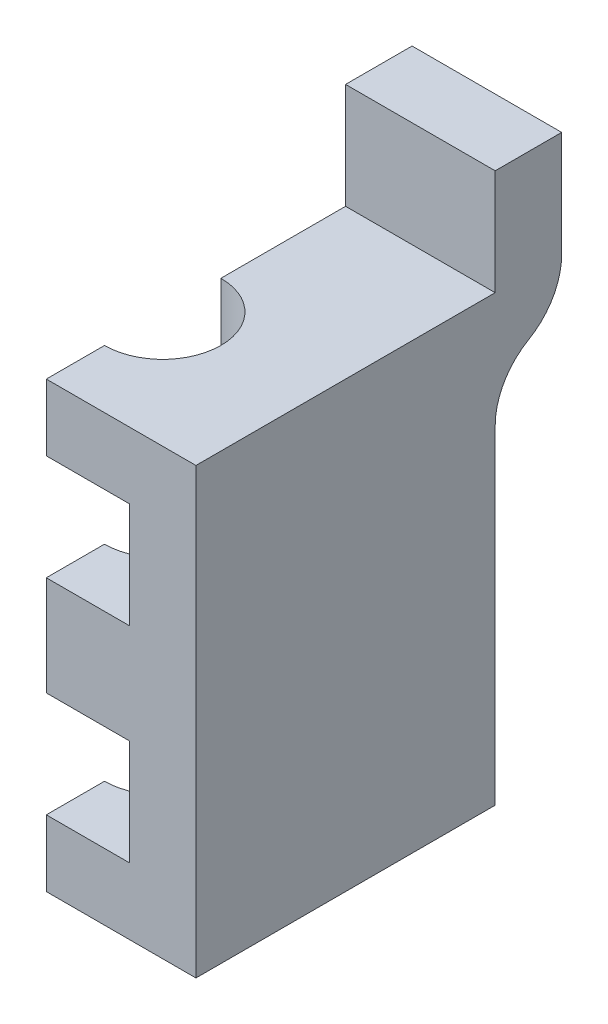
from build123d import *

# Parameters (mm, degrees)
BOSS_EXTRUDE3_DEPTH = 3.5
SKETCH6_W           = 4.5
SKETCH6_H           = 13.35
BOSS_EXTRUDE4_DEPTH = 2
SKETCH7_R           = 1.75
CUT_EXTRUDE2_DEPTH  = 16.123574313
BOSS_EXTRUDE7_DEPTH = 4.5
FILLET1_R           = 2


with BuildPart() as part:
    # Sketch5 → Boss-Extrude3 (new, symmetric)
    with BuildSketch(Plane.XY):
        Polygon((0, 0), (4.5, 0), (4.5, -13.35), (0, -13.35), (0, -11.35), (2.5, -11.35), (2.5, -8.175), (0, -8.175), (0, -5.175), (2.5, -5.175), (2.5, -2), (0, -2), align=None)
    extrude(amount=BOSS_EXTRUDE3_DEPTH, both=True)

    # Sketch6 → Boss-Extrude4 (add)
    with BuildSketch(Plane(origin=(0, 0, -3.5), x_dir=(-1, 0, 0), z_dir=(0, 0, -1))):
        with Locations((-2.25, -6.675)):
            Rectangle(SKETCH6_W, SKETCH6_H)
    extrude(amount=BOSS_EXTRUDE4_DEPTH)

    # Sketch7 → Cut-Extrude2 (cut, through all)
    with BuildSketch(Plane(origin=(0, 0, 0), x_dir=(1, 0, 0), z_dir=(0, 1, 0))):
        Circle(SKETCH7_R)
    extrude(amount=-CUT_EXTRUDE2_DEPTH, mode=Mode.SUBTRACT)

    # Sketch9 → Boss-Extrude7 (add, through all)
    with BuildSketch(Plane.ZY):
        with BuildLine():
            Line((-7.5, 3.175), (-5.5, 3.175))
            Line((-5.5, 3.175), (-5.5, 0))
            Line((-5.5, 0), (-5.5, -2))
            ThreePointArc((-5.5, -2), (-6.914213562, -1.414213562), (-7.5, 0))
            Line((-7.5, 0), (-7.5, 3.175))
        make_face()
    extrude(amount=-BOSS_EXTRUDE7_DEPTH)

    # Fillet1
    fillet1_edges = [part.edges().sort_by_distance(p)[0] for p in [
        (2.25, -2, -5.5),
    ]]
    fillet(fillet1_edges, radius=FILLET1_R)


solid = part.part
